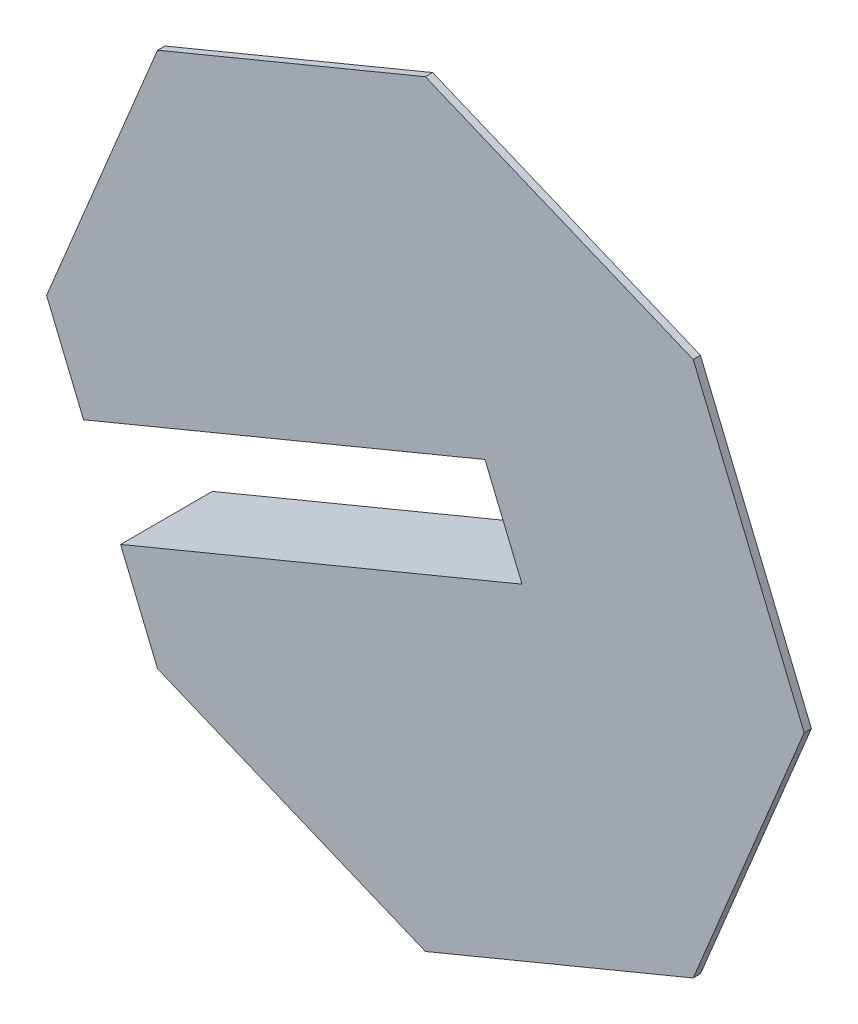
from build123d import *

# Parameters (mm, degrees)
BOSS_EXTRUDE4_DEPTH = 3
BOSS_EXTRUDE5_START = -179.852814
SKETCH7_W           = 3
SKETCH7_H           = 35
BOSS_EXTRUDE5_DEPTH = 179.852814


with BuildPart() as part:
    # Sketch6 → Boss-Extrude4 (new body)
    with BuildSketch(Plane(origin=(0, 0, 0), x_dir=(0, 1, 0), z_dir=(0, 0, 1))):
        Polygon((156.787555785, 0), (110.865543901, 110.865543901), (0, 156.787555785), (-36.922845517, 141.493612411), (31.903846567, -24.66872107), (-5.116006301, -40.002846205), (-73.942698385, 126.159487276), (-110.865543901, 110.865543901), (-156.787555785, 0), (-110.865543901, -110.865543901), (0, -156.787555785), (110.865543901, -110.865543901), align=None)
    extrude(amount=BOSS_EXTRUDE4_DEPTH)

    # Sketch7 → Boss-Extrude5 (add)
    with BuildSketch(Plane(origin=(-133.826549843, -55.432771951, 0), x_dir=(0.38268343236508956, -0.9238795325112868, 0), z_dir=(-0.9238795325112868, -0.38268343236508956, 0)).offset(BOSS_EXTRUDE5_START)):
        with Locations((21.535, -17.5)):
            Rectangle(SKETCH7_W, SKETCH7_H)
    extrude(amount=BOSS_EXTRUDE5_DEPTH)


solid = part.part
